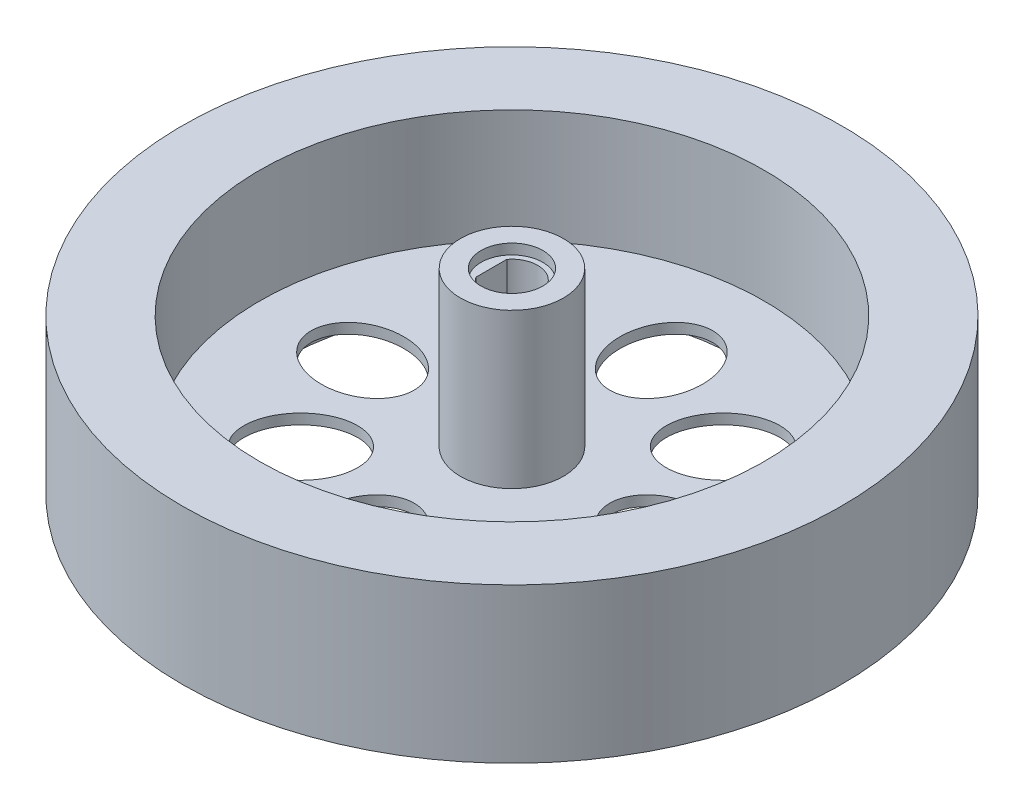
from build123d import *

# Parameters (mm, degrees)
SKETCH1_R           = 32
BOSS_EXTRUDE1_DEPTH = 15
SKETCH2_R           = 22.5
CUT_EXTRUDE1_DEPTH  = 3
SKETCH3_R           = 7.5
BOSS_EXTRUDE2_DEPTH = 2
SKETCH4_R           = 24.5
CUT_EXTRUDE2_DEPTH  = 11
SKETCH5_R           = 5
BOSS_EXTRUDE3_DEPTH = 15
SKETCH6_RX          = 5
SKETCH6_RY          = 4
CUT_EXTRUDE3_DEPTH  = 48.675989764
SKETCH7_R           = 3
CUT_EXTRUDE4_DEPTH  = 1
CUT_EXTRUDE5_DEPTH  = 7


with BuildPart() as part:
    # Sketch1 → Boss-Extrude1 (new body)
    with BuildSketch(Plane(origin=(0, 0, 0), x_dir=(1, 0, 0), z_dir=(0, 1, 0))):
        with Locations(Location((0, 0, 0), (0, 0, 270))):
            Circle(SKETCH1_R)
    extrude(amount=BOSS_EXTRUDE1_DEPTH)

    # Sketch2 → Cut-Extrude1 (cut)
    with BuildSketch(Plane.XZ):
        with Locations(Location((0, 0, 0), (0, 0, 270))):
            Circle(SKETCH2_R)
    extrude(amount=-CUT_EXTRUDE1_DEPTH, mode=Mode.SUBTRACT)

    # Sketch3 → Boss-Extrude2 (add)
    with BuildSketch(Plane.XZ.offset(-3)):
        with Locations(Location((0, 0, 0), (0, 0, 270))):
            Circle(SKETCH3_R)
    extrude(amount=BOSS_EXTRUDE2_DEPTH)

    # Sketch4 → Cut-Extrude2 (cut)
    with BuildSketch(Plane(origin=(0, 15, 0), x_dir=(1, 0, 0), z_dir=(0, 1, 0))):
        with Locations(Location((0, 0, 0), (0, 0, 270))):
            Circle(SKETCH4_R)
    extrude(amount=-CUT_EXTRUDE2_DEPTH, mode=Mode.SUBTRACT)

    # Sketch5 → Boss-Extrude3 (add)
    with BuildSketch(Plane(origin=(0, 4, 0), x_dir=(1, 0, 0), z_dir=(0, 1, 0))):
        with Locations(Location((0, 0, 0), (0, 0, 270))):
            Circle(SKETCH5_R)
    extrude(amount=BOSS_EXTRUDE3_DEPTH)

    # Sketch6 → Cut-Extrude3 (cut, through all)
    with BuildSketch(Plane(origin=(0, 4, 0), x_dir=(1, 0, 0), z_dir=(0, 1, 0))):
        with Locations(Location((0, -14.5), (0, 0, -90))):
            Ellipse(SKETCH6_RX, SKETCH6_RY)
        with Locations(Location((-10.253048327, -10.253048327), (0, 0, -135))):
            Ellipse(SKETCH6_RX, SKETCH6_RY)
        with Locations(Location((-14.5, 0), (0, 0, 180))):
            Ellipse(SKETCH6_RX, SKETCH6_RY)
        with Locations(Location((-10.253048327, 10.253048327), (0, 0, 135))):
            Ellipse(SKETCH6_RX, SKETCH6_RY)
        with Locations(Location((0, 14.5), (0, 0, 90))):
            Ellipse(SKETCH6_RX, SKETCH6_RY)
        with Locations(Location((10.253048327, 10.253048327), (0, 0, -135))):
            Ellipse(SKETCH6_RX, SKETCH6_RY)
        with Locations(Location((14.5, 0), (0, 0, 0))):
            Ellipse(SKETCH6_RX, SKETCH6_RY)
        with Locations(Location((10.253048327, -10.253048327), (0, 0, -45))):
            Ellipse(SKETCH6_RX, SKETCH6_RY)
    extrude(amount=-CUT_EXTRUDE3_DEPTH, mode=Mode.SUBTRACT)

    # Sketch7 → Cut-Extrude4 (cut)
    with BuildSketch(Plane(origin=(0, 19, 0), x_dir=(1, 0, 0), z_dir=(0, 1, 0))):
        with Locations(Location((0, 0, 0), (0, 0, 270))):
            Circle(SKETCH7_R)
    extrude(amount=-CUT_EXTRUDE4_DEPTH, mode=Mode.SUBTRACT)

    # Sketch8 → Cut-Extrude5 (cut)
    with BuildSketch(Plane(origin=(0, 18, 0), x_dir=(1, 0, 0), z_dir=(0, 1, 0))):
        with BuildLine():
            Line((2, -1.5), (2, 1.5))
            ThreePointArc((2, 1.5), (0, 2.5), (-2, 1.5))
            Line((-2, 1.5), (-2, -1.5))
            ThreePointArc((-2, -1.5), (0, -2.5), (2, -1.5))
        make_face()
    extrude(amount=-CUT_EXTRUDE5_DEPTH, mode=Mode.SUBTRACT)


solid = part.part
